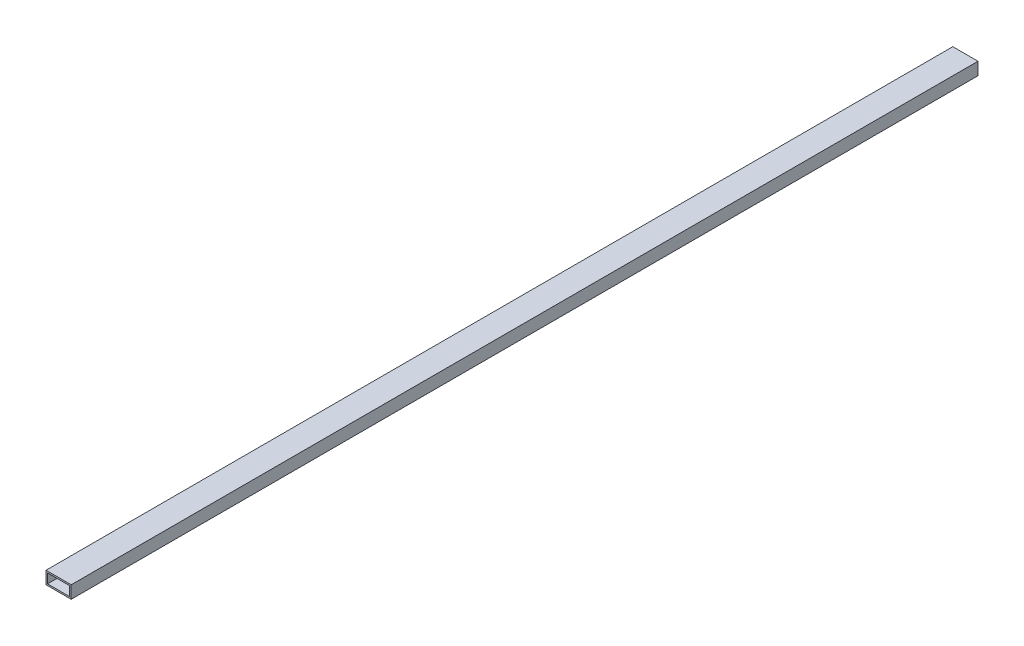
from build123d import *

# Parameters (mm, degrees)
BOSS_EXTRUDE1_DEPTH      = 457.2
BOSS_EXTRUDE1_DEPTH_BACK = 457.2
SKETCH3_W                = 25.4
SKETCH3_H                = 12.7
SKETCH3_W_2              = 22.225
SKETCH3_H_2              = 9.525


with BuildPart() as part:
    # Sketch3 → Boss-Extrude1 (new, two sides: drawn at the far end of the back side and taken through both)
    with BuildSketch(Plane.XY.offset(-BOSS_EXTRUDE1_DEPTH_BACK)):
        Rectangle(SKETCH3_W, SKETCH3_H)
        Rectangle(SKETCH3_W_2, SKETCH3_H_2, mode=Mode.SUBTRACT)
    extrude(amount=BOSS_EXTRUDE1_DEPTH + BOSS_EXTRUDE1_DEPTH_BACK)


solid = part.part
